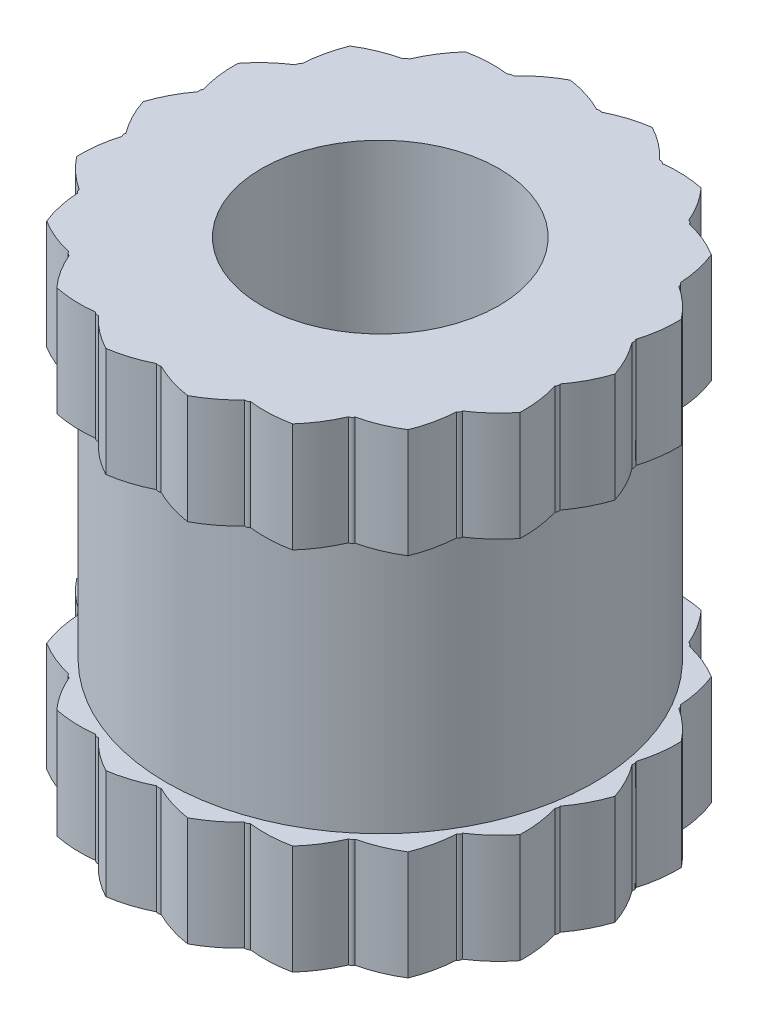
from build123d import *

# Parameters (mm, degrees)
SKETCH1_R           = 2.51
BOSS_EXTRUDE1_DEPTH = 5
CUT_EXTRUDE2_DEPTH  = 5
CIRPATTERN1_COUNT   = 18
M3_TAPPED_HOLE1_D   = 2.5
SKETCH8_R           = 3.25
SKETCH8_R_2         = 2.25
CUT_EXTRUDE3_DEPTH  = 2.7


with BuildPart() as part:
    # Sketch1 → Boss-Extrude1 (new body)
    with BuildSketch(Plane(origin=(0, 0, 0), x_dir=(1, 0, 0), z_dir=(0, 1, 0))):
        with Locations(Location((0, 0, 0), (0, 0, 270))):
            Circle(SKETCH1_R)
    extrude(amount=BOSS_EXTRUDE1_DEPTH)

    # Sketch2 → Cut-Extrude2 (cut)
    with BuildSketch(Plane(origin=(0, 5, 0), x_dir=(1, 0, 0), z_dir=(0, 1, 0))):
        with BuildLine():
            ThreePointArc((0.569091169, 2.444633969), (0, 2.615621061), (-0.569091169, 2.444633969))
            ThreePointArc((-0.569091169, 2.444633969), (-0.289139314, 2.403802024), (-0.024469936, 2.303849986))
            ThreePointArc((-0.024469936, 2.303849986), (0, 2.310246979), (0.024469936, 2.303849986))
            ThreePointArc((0.024469936, 2.303849986), (0.289139314, 2.403802024), (0.569091169, 2.444633969))
        make_face()
    cut_extrude2 = extrude(amount=-CUT_EXTRUDE2_DEPTH, mode=Mode.SUBTRACT)

    # CirPattern1: Cut-Extrude2 ×18 about axis
    cirpattern1_axis = Axis((0, 0, 0.013606971), (0, 1, 0))
    for i in range(1, CIRPATTERN1_COUNT):
        add(cut_extrude2.rotate(cirpattern1_axis, i * 360 / CIRPATTERN1_COUNT), mode=Mode.SUBTRACT)

    # M3 Tapped Hole1 (through all)
    with Locations(Plane(origin=(0, 5, 0), x_dir=(1, 0, 0), z_dir=(0, 1, 0))):
        with Locations((0, 0)):
            Hole(M3_TAPPED_HOLE1_D / 2)

    # Sketch8 → Cut-Extrude3 (cut)
    with BuildSketch(Plane(origin=(0, 3.85, 0), x_dir=(1, 0, 0), z_dir=(0, 1, 0))):
        Circle(SKETCH8_R)
        with Locations(Location((0, 0, 0), (0, 0, 270))):
            Circle(SKETCH8_R_2, mode=Mode.SUBTRACT)
    extrude(amount=-CUT_EXTRUDE3_DEPTH, mode=Mode.SUBTRACT)


solid = part.part
